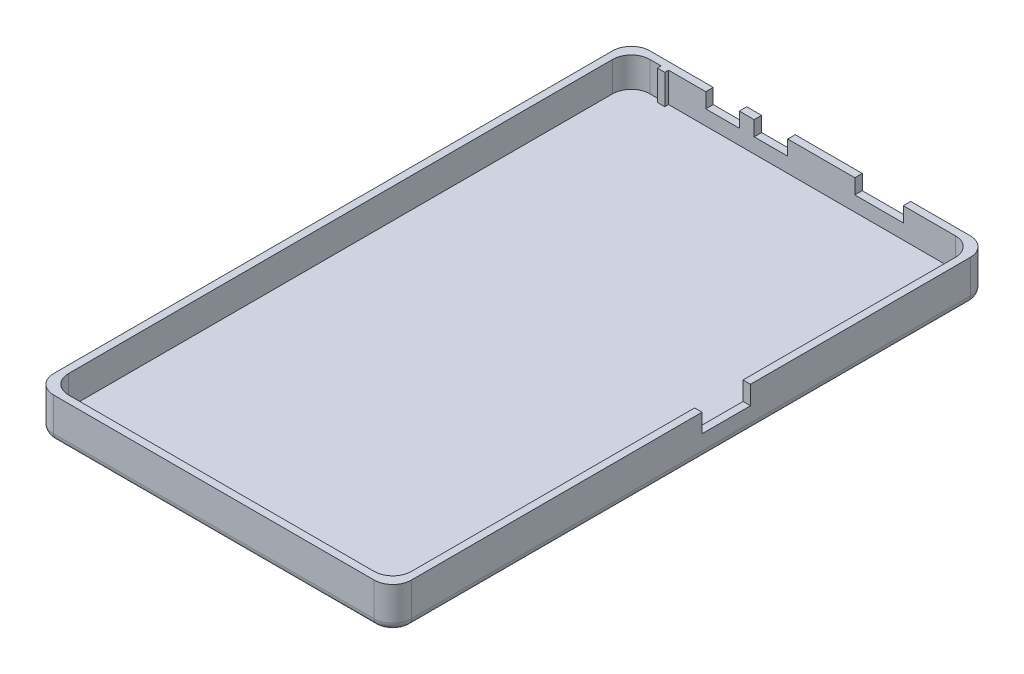
from build123d import *

# Parameters (mm, degrees)
SKETCH_1_W          = 96
SKETCH_1_H          = 160
EXTRUDE_1_DEPTH     = 11
FILLET_1_R          = 5
FILLET_2_R          = 5
FILLET_3_R          = 5
FILLET_4_R          = 5
FILLET_5_R          = 2
CUT_EXTRUDE_1_DEPTH = 8
SKETCH_3_W          = 9
SKETCH_3_H          = 4
SKETCH_3_W_2        = 13
CUT_EXTRUDE_2_DEPTH = 4
SKETCH_4_W          = 13
SKETCH_4_H          = 5
CUT_EXTRUDE_3_DEPTH = 5


with BuildPart() as part:
    # 草图1 → 凸台-拉伸1 (new body)
    with BuildSketch(Plane(origin=(0, 0, 0), x_dir=(1, 0, 0), z_dir=(0, 1, 0))):
        Rectangle(SKETCH_1_W, SKETCH_1_H)
    extrude(amount=EXTRUDE_1_DEPTH)

    # 圆角1
    fillet_1_edges = [part.edges().sort_by_distance(p)[0] for p in [
        (-48, 5.5, -80),
    ]]
    fillet(fillet_1_edges, radius=FILLET_1_R)

    # 圆角2
    fillet_2_edges = [part.edges().sort_by_distance(p)[0] for p in [
        (48, 5.5, -80),
    ]]
    fillet(fillet_2_edges, radius=FILLET_2_R)

    # 圆角3
    fillet_3_edges = [part.edges().sort_by_distance(p)[0] for p in [
        (48, 5.5, 80),
    ]]
    fillet(fillet_3_edges, radius=FILLET_3_R)

    # 圆角4
    fillet_4_edges = [part.edges().sort_by_distance(p)[0] for p in [
        (-48, 5.5, 80),
    ]]
    fillet(fillet_4_edges, radius=FILLET_4_R)

    # 圆角5
    fillet_5_edges = [part.edges().sort_by_distance(p)[0] for p in [
        (-48, 0, 0),
        (-46.535533906, 0, -78.535533906),
        (0, 0, -80),
        (46.535533906, 0, -78.535533906),
        (48, 0, 0),
        (46.535533906, 0, 78.535533906),
        (0, 0, 80),
        (-46.535533906, 0, 78.535533906),
    ]]
    fillet(fillet_5_edges, radius=FILLET_5_R)

    # 草图2 → 切除-拉伸1 (cut)
    with BuildSketch(Plane(origin=(0, 11, 0), x_dir=(1, 0, 0), z_dir=(0, 1, 0))):
        with BuildLine():
            Line((-36, 78), (41, 78))
            ThreePointArc((41, 78), (44.535533906, 76.535533906), (46, 73))
            Line((46, 73), (46, -73))
            ThreePointArc((46, -73), (44.535533906, -76.535533906), (41, -78))
            Line((41, -78), (-41, -78))
            ThreePointArc((-41, -78), (-44.535533906, -76.535533906), (-46, -73))
            Line((-46, -73), (-46, 73))
            ThreePointArc((-46, 73), (-44.535533906, 76.535533906), (-41, 78))
            Line((-41, 78), (-38, 78))
            Line((-38, 78), (-38, 77))
            Line((-38, 77), (-36, 77))
            Line((-36, 77), (-36, 78))
        make_face()
    extrude(amount=-CUT_EXTRUDE_1_DEPTH, mode=Mode.SUBTRACT)

    # 草图3 → 切除-拉伸2 (cut)
    with BuildSketch(Plane.XY.offset(-78)):
        with Locations((-21.5, 9)):
            Rectangle(SKETCH_3_W, SKETCH_3_H)
        with Locations((-8.5, 9)):
            Rectangle(SKETCH_3_W, SKETCH_3_H)
        with Locations((16.277912798, 56.653498761)):
            Rectangle(SKETCH_3_W, SKETCH_3_H)
        with Locations((20.5, 9)):
            Rectangle(SKETCH_3_W_2, SKETCH_3_H)
    extrude(amount=-CUT_EXTRUDE_2_DEPTH, mode=Mode.SUBTRACT)

    # 草图4 → 切除-拉伸3 (cut)
    with BuildSketch(Plane(origin=(48, 0, 0), x_dir=(0, 0, -1), z_dir=(1, 0, 0))):
        with Locations((9.5, 8.5)):
            Rectangle(SKETCH_4_W, SKETCH_4_H)
    extrude(amount=-CUT_EXTRUDE_3_DEPTH, mode=Mode.SUBTRACT)


solid = part.part
